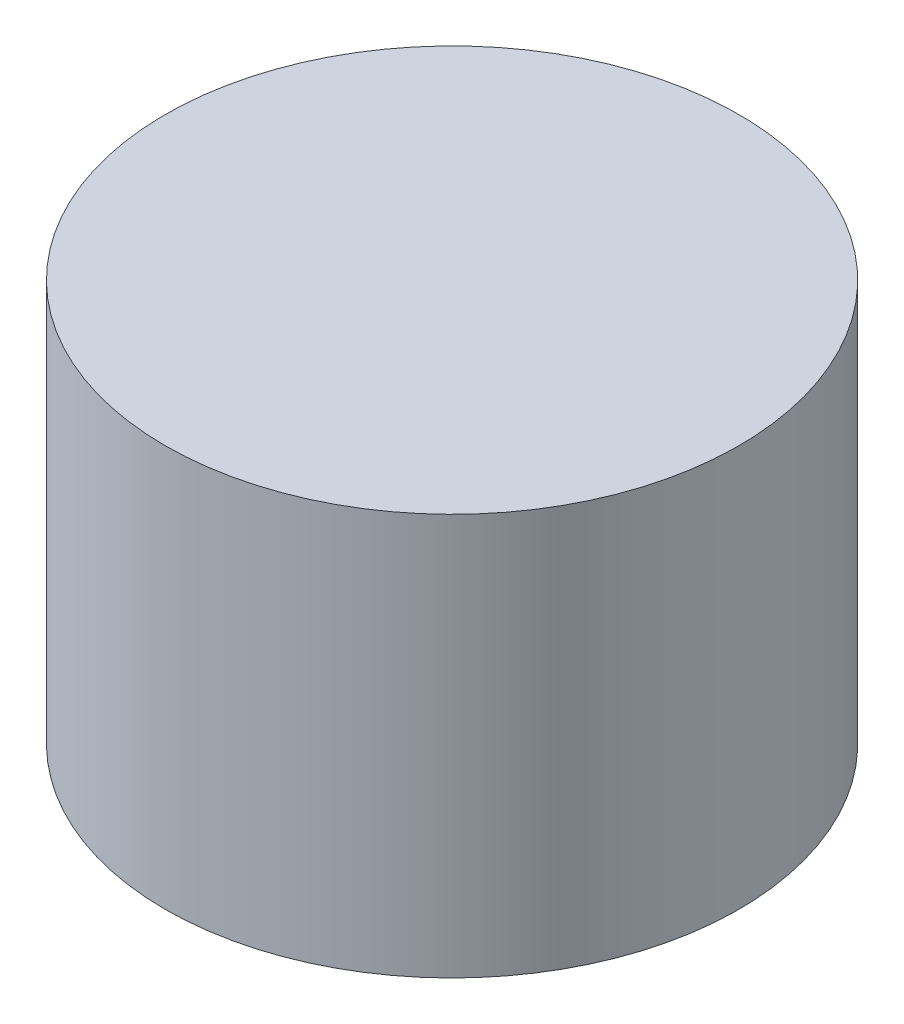
from build123d import *

# Parameters (mm, degrees)
SKETCH1_R           = 5
SKETCH1_R_2         = 4
BOSS_EXTRUDE1_DEPTH = 5
SKETCH2_R           = 5
BOSS_EXTRUDE2_DEPTH = 2


with BuildPart() as part:
    # Sketch1 → Boss-Extrude1 (new body)
    with BuildSketch(Plane(origin=(0, 0, 0), x_dir=(1, 0, 0), z_dir=(0, 1, 0))):
        with Locations(Location((0, 0, 0), (0, 0, 270))):
            Circle(SKETCH1_R)
        with Locations(Location((0, 0, 0), (0, 0, 270))):
            Circle(SKETCH1_R_2, mode=Mode.SUBTRACT)
    extrude(amount=BOSS_EXTRUDE1_DEPTH)

    # Sketch2 → Boss-Extrude2 (add)
    with BuildSketch(Plane(origin=(0, 5, 0), x_dir=(1, 0, 0), z_dir=(0, 1, 0))):
        with Locations(Location((0, 0, 0), (0, 0, 270))):
            Circle(SKETCH2_R)
    extrude(amount=BOSS_EXTRUDE2_DEPTH)


solid = part.part
